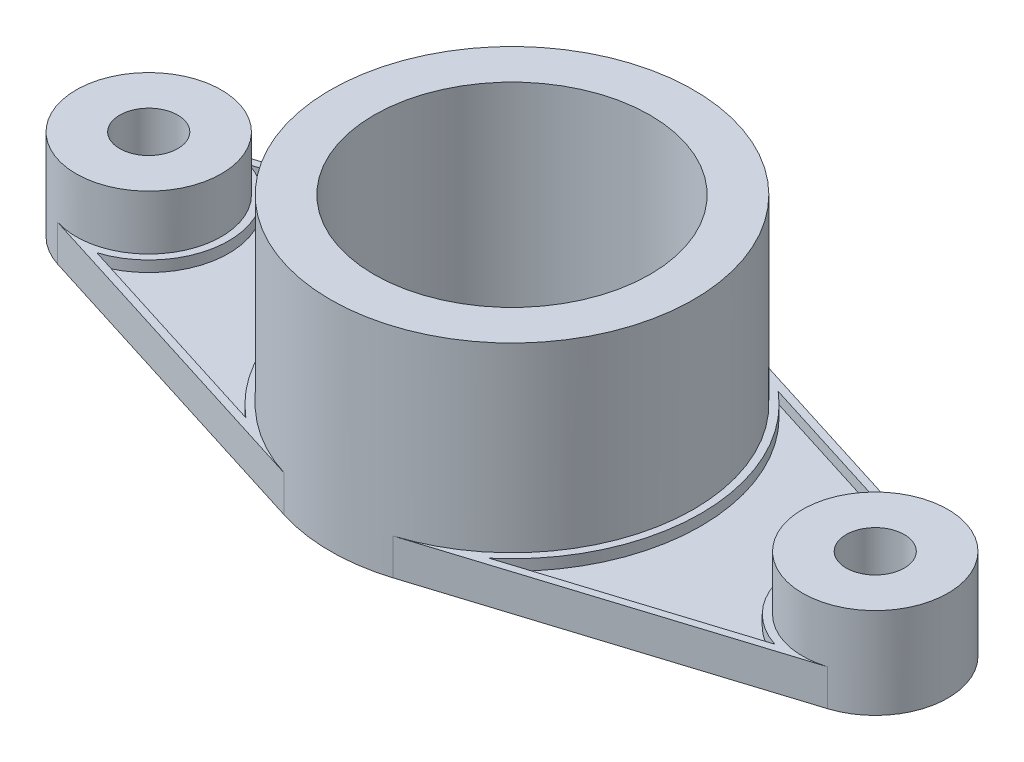
from build123d import *

# Parameters (mm, degrees)
SKETCH1_R           = 8
SKETCH1_R_2         = 38
BOSS_EXTRUDE1_DEPTH = 10
SKETCH1_3_R         = 20
SKETCH1_3_R_2       = 8
BOSS_EXTRUDE2_DEPTH = 25
SKETCH1_4_R         = 38
BOSS_EXTRUDE3_DEPTH = 60
CUT_EXTRUDE1_DEPTH  = 3


with BuildPart() as part:
    # Sketch1 → Boss-Extrude1 (new body)
    with BuildSketch(Plane(origin=(0, 0, 0), x_dir=(1, 0, 0), z_dir=(0, 1, 0))):
        with BuildLine():
            Line((106, 19.078784028), (15, 47.696960071))
            ThreePointArc((15, 47.696960071), (0, 50), (-15, 47.696960071))
            Line((-15, 47.696960071), (-106, 19.078784028))
            ThreePointArc((-106, 19.078784028), (-120, 0), (-106, -19.078784028))
            Line((-106, -19.078784028), (-15, -47.696960071))
            ThreePointArc((-15, -47.696960071), (0, -50), (15, -47.696960071))
            Line((15, -47.696960071), (106, -19.078784028))
            ThreePointArc((106, -19.078784028), (120, 0), (106, 19.078784028))
        make_face()
        with Locations((100, 0)):
            Circle(SKETCH1_R, mode=Mode.SUBTRACT)
        Circle(SKETCH1_R_2, mode=Mode.SUBTRACT)
        with Locations((-100, 0)):
            Circle(SKETCH1_R, mode=Mode.SUBTRACT)
    extrude(amount=BOSS_EXTRUDE1_DEPTH)

    # Sketch1<3> → Boss-Extrude2 (add)
    # profile 1 of 2: a face of its own
    with BuildSketch(Plane(origin=(0, 0, 0), x_dir=(1, 0, 0), z_dir=(0, 1, 0))):
        with Locations((100, 0)):
            Circle(SKETCH1_3_R)
        with Locations((100, 0)):
            Circle(SKETCH1_3_R_2, mode=Mode.SUBTRACT)
    # profile 2 of 2: a face of its own
    with BuildSketch(Plane(origin=(0, 0, 0), x_dir=(1, 0, 0), z_dir=(0, 1, 0))):
        with Locations((-100, 0)):
            Circle(SKETCH1_3_R)
        with Locations((-100, 0)):
            Circle(SKETCH1_3_R_2, mode=Mode.SUBTRACT)
    extrude(amount=BOSS_EXTRUDE2_DEPTH)

    # Sketch1<4> → Boss-Extrude3 (add)
    with BuildSketch(Plane(origin=(0, 0, 0), x_dir=(1, 0, 0), z_dir=(0, 1, 0))):
        with BuildLine():
            ThreePointArc((50, 0), (40.311288741, 29.580398915), (15, 47.696960071))
            ThreePointArc((15, 47.696960071), (0, 50), (-15, 47.696960071))
            ThreePointArc((-15, 47.696960071), (-50, 0), (-15, -47.696960071))
            ThreePointArc((-15, -47.696960071), (0, -50), (15, -47.696960071))
            ThreePointArc((15, -47.696960071), (40.311288741, -29.580398915), (50, 0))
        make_face()
        Circle(SKETCH1_4_R, mode=Mode.SUBTRACT)
    extrude(amount=BOSS_EXTRUDE3_DEPTH)

    # Sketch5 → Cut-Extrude1 (cut)
    with BuildSketch(Plane(origin=(0, 10, 0), x_dir=(1, 0, 0), z_dir=(0, 1, 0))):
        with BuildLine():
            Line((-33.478784028, -39.789081668), (-93.333517497, -20.965638818))
            ThreePointArc((-93.333517497, -20.965638818), (-78, 0), (-93.333517497, 20.965638818))
            Line((-93.333517497, 20.965638818), (-33.478784028, 39.789081668))
            ThreePointArc((-33.478784028, 39.789081668), (-52, 0), (-33.478784028, -39.789081668))
        make_face()
        with BuildLine():
            Line((93.333517497, 20.965638818), (33.478784028, 39.789081668))
            ThreePointArc((33.478784028, 39.789081668), (52, 0), (33.478784028, -39.789081668))
            Line((33.478784028, -39.789081668), (93.333517497, -20.965638818))
            ThreePointArc((93.333517497, -20.965638818), (78, 0), (93.333517497, 20.965638818))
        make_face()
    extrude(amount=-CUT_EXTRUDE1_DEPTH, mode=Mode.SUBTRACT)


solid = part.part
